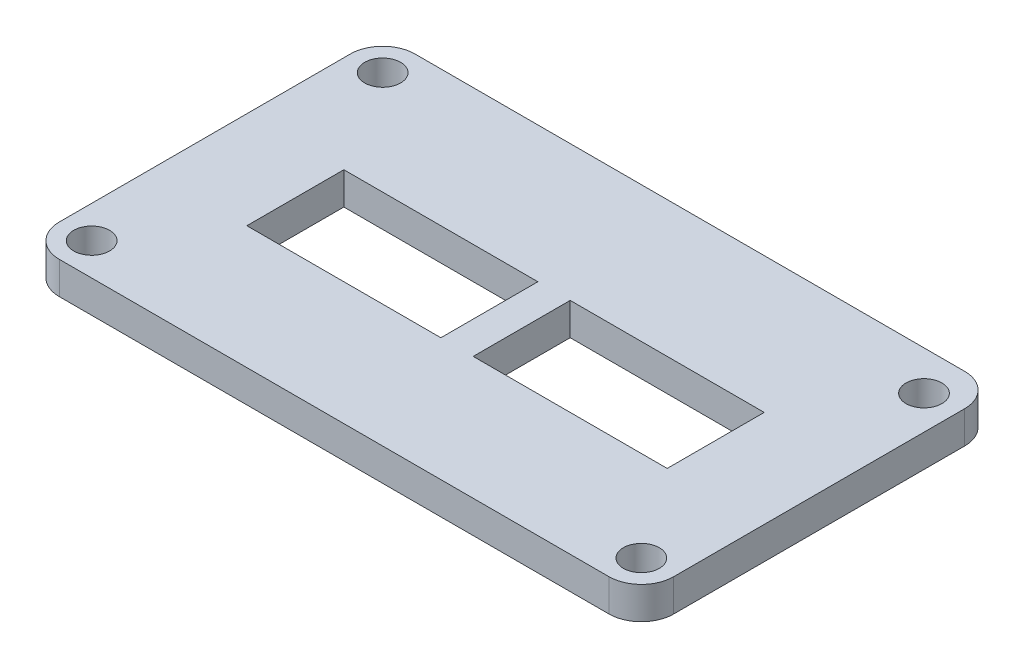
from build123d import *

# Parameters (mm, degrees)
SKETCH1_W                   = 48.26
SKETCH1_H                   = 27.94
BOSS_EXTRUDE1_DEPTH         = 2.54
SKETCH2_W                   = 15.24
SKETCH2_H                   = 7.62
CUT_EXTRUDE1_DEPTH          = 15.494
FILLET1_R                   = 2.54
F_34_0_111_DIAMETER_HOLE1_D = 2.8194


with BuildPart() as part:
    # Sketch1 → Boss-Extrude1 (new body)
    with BuildSketch(Plane(origin=(0, 0, 0), x_dir=(1, 0, 0), z_dir=(0, 1, 0))):
        Rectangle(SKETCH1_W, SKETCH1_H)
    extrude(amount=BOSS_EXTRUDE1_DEPTH)

    # Sketch2 → Cut-Extrude1 (cut)
    with BuildSketch(Plane(origin=(0, 2.54, 0), x_dir=(1, 0, 0), z_dir=(0, 1, 0))):
        with Locations((-8.89, -0.508)):
            Rectangle(SKETCH2_W, SKETCH2_H)
        with Locations((8.89, -0.508)):
            Rectangle(SKETCH2_W, SKETCH2_H)
    extrude(amount=-CUT_EXTRUDE1_DEPTH, mode=Mode.SUBTRACT)

    # Fillet1
    fillet1_edges = [part.edges().sort_by_distance(p)[0] for p in [
        (-24.13, 1.27, 13.97),
        (-24.13, 1.27, -13.97),
        (24.13, 1.27, -13.97),
        (24.13, 1.27, 13.97),
    ]]
    fillet(fillet1_edges, radius=FILLET1_R)

    # #34 (0.111) Diameter Hole1 (through all)
    with Locations(Plane(origin=(0, 2.54, 0), x_dir=(1, 0, 0), z_dir=(0, 1, 0))):
        with Locations((21.483576639, 10.878336476), (21.59, -11.43), (-21.59, -11.43), (-21.59, 11.43)):
            Hole(F_34_0_111_DIAMETER_HOLE1_D / 2)


solid = part.part
